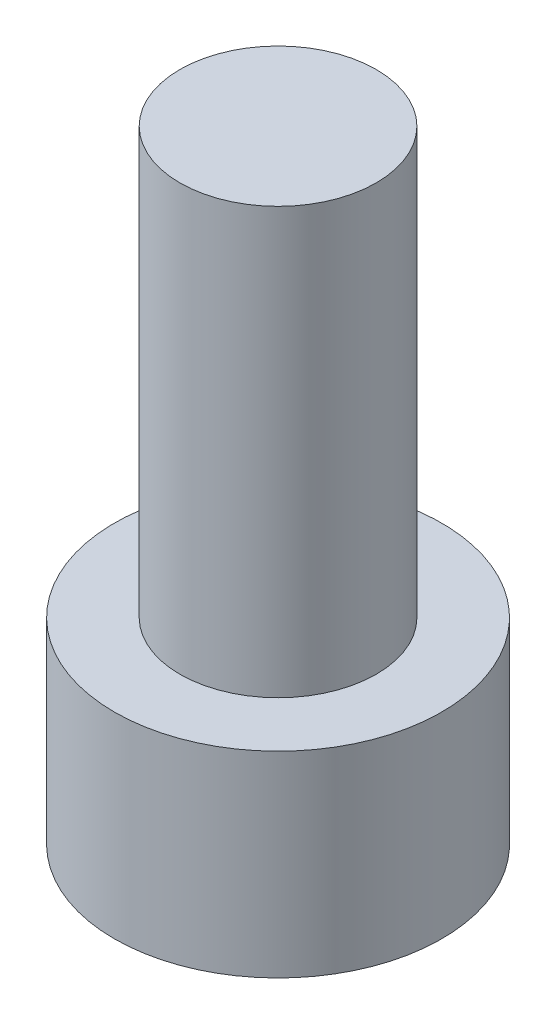
from build123d import *

# Parameters (mm, degrees)
SKETCH_1_R      = 5
EXTRUDE_1_DEPTH = 6
SKETCH_2_R      = 3
EXTRUDE_2_DEPTH = 13


with BuildPart() as part:
    # 草图1 → 凸台-拉伸1 (new body)
    with BuildSketch(Plane(origin=(0, 0, 0), x_dir=(1, 0, 0), z_dir=(0, 1, 0))):
        with Locations(Location((0, 0, 0), (0, 0, 270))):
            Circle(SKETCH_1_R)
    extrude(amount=EXTRUDE_1_DEPTH)

    # 草图2 → 凸台-拉伸2 (add)
    with BuildSketch(Plane(origin=(0, 6, 0), x_dir=(1, 0, 0), z_dir=(0, 1, 0))):
        with Locations(Location((0, 0, 0), (0, 0, 90))):
            Circle(SKETCH_2_R)
    extrude(amount=EXTRUDE_2_DEPTH)


solid = part.part
